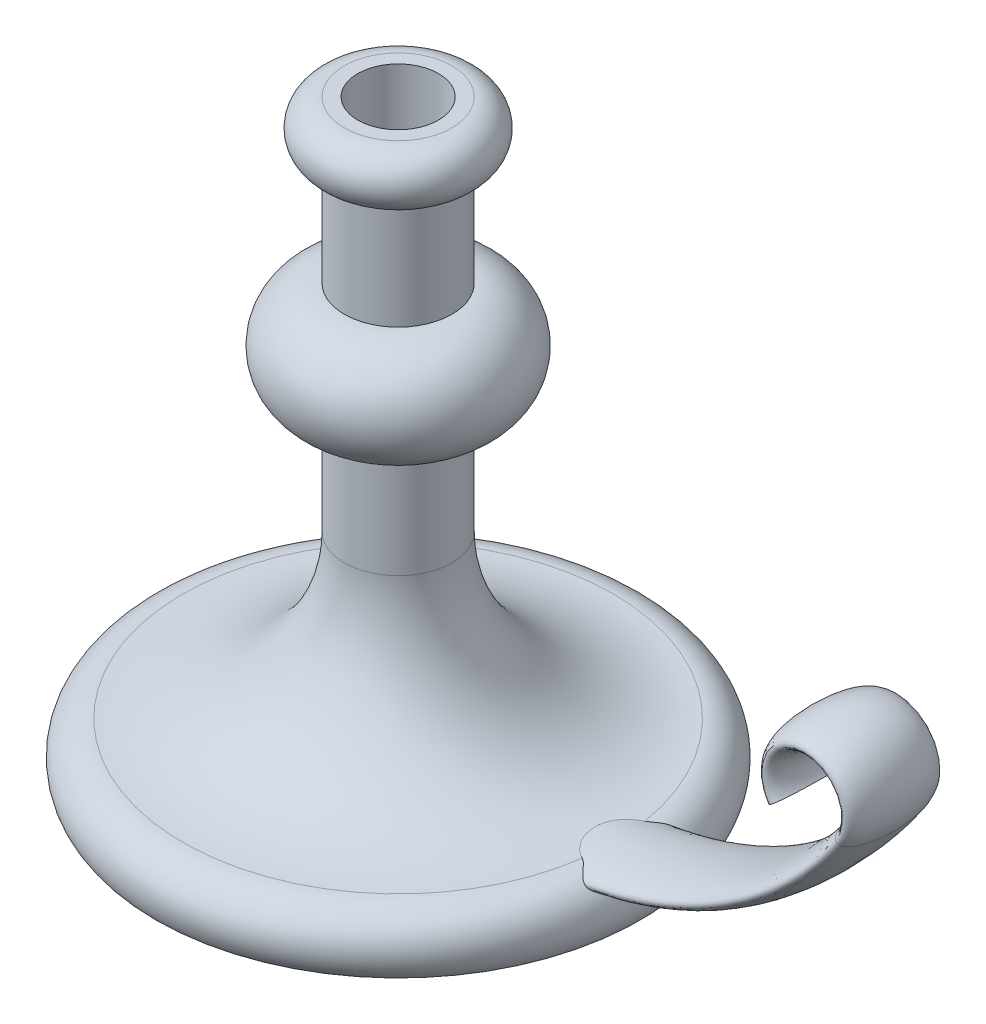
from build123d import *

# Parameters (mm, degrees)
CROQUIS4_RX           = 17.5
CROQUIS4_RY           = 5
CROQUIS5_R            = 15
CORTAR_EXTRUIR1_DEPTH = 25


with BuildPart() as part:
    # Croquis1 → Revolución1 (revolve)
    with BuildSketch(Plane.XY, mode=Mode.PRIVATE) as revoluci_n1_sk:
        with BuildLine():
            Line((0, 0), (0, 220))
            Line((0, 220), (20, 220))
            ThreePointArc((20, 220), (30, 210), (20, 200))
            Line((20, 200), (20, 160))
            ThreePointArc((20, 160), (40, 140), (20, 120))
            Line((20, 120), (20, 80))
            ThreePointArc((20, 80), (37.573593129, 37.573593129), (80, 20))
            ThreePointArc((80, 20), (91.180339887, 13.090169944), (90, 0))
            Line((90, 0), (0, 0))
        make_face()
    revolve(revoluci_n1_sk.sketch.rotate(Axis((0, 0, 0), (0, 1, 0)), 90), axis=Axis((0, 0, 0), (0, 1, 0)))

    # Barrer1: sweep along a path in Croquis2
    with BuildLine(Plane.XY) as barrer1_path:
        Line((0, 10), (60, 10))
        ThreePointArc((60, 10), (129.821200219, 27.240819526), (183.592070943, 75))
        ThreePointArc((183.592070943, 75), (167.113128151, 106.333333333), (150.634185358, 75))
    # Croquis4 → Barrer1 (sweep)
    with BuildSketch(Plane(origin=(0, 0, 0), x_dir=(0, 0, -1), z_dir=(1, 0, 0))):
        with Locations((1.015476046, 15)):
            Ellipse(CROQUIS4_RX, CROQUIS4_RY)
    sweep(path=barrer1_path.line)

    # Croquis5 → Cortar-Extruir1 (cut)
    with BuildSketch(Plane(origin=(0, 220, 0), x_dir=(1, 0, 0), z_dir=(0, 1, 0))):
        with Locations(Location((0, 0, 0), (0, 0, 270))):
            Circle(CROQUIS5_R)
    extrude(amount=-CORTAR_EXTRUIR1_DEPTH, mode=Mode.SUBTRACT)


solid = part.part
